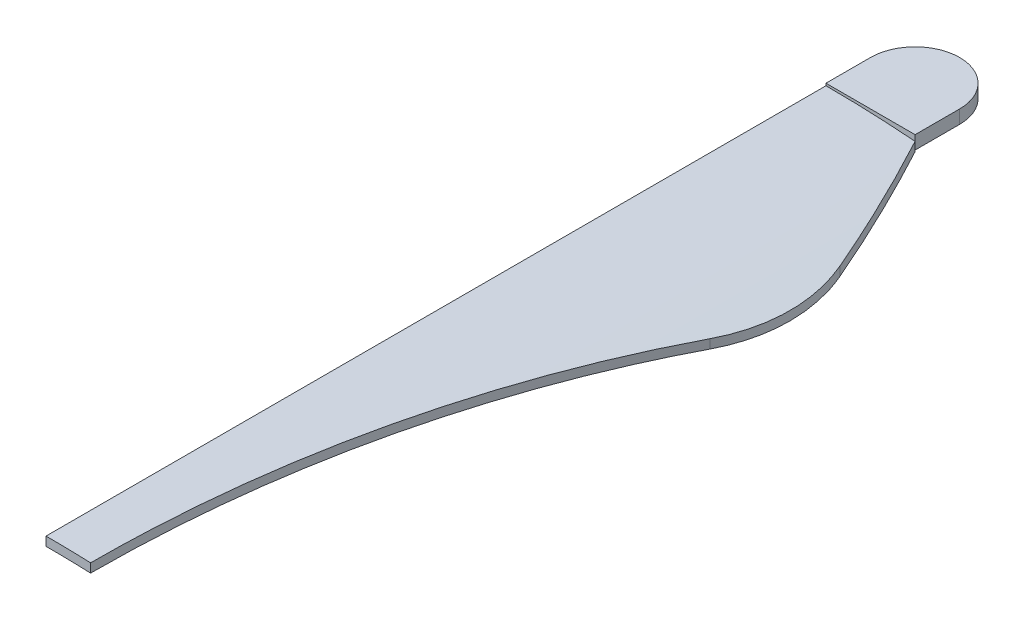
from build123d import *

# Parameters (mm, degrees)
EXTRUDE_1_DEPTH          = 350
EXTRUDE_2_DEPTH          = 1
EXTRUDE_2_DEPTH_BACK     = 5
CUT_EXTRUDE_1_DEPTH      = 360.210404844
CUT_EXTRUDE_1_DEPTH_BACK = 360.210404844
SKETCH_4_OUTSIDE_W       = 161.658
SKETCH_4_OUTSIDE_H       = 471.658


with BuildPart() as part:
    # 草图2 → 凸台-拉伸1 (new body)
    with BuildSketch(Plane.XY):
        with BuildLine():
            Line((80, -10.494126695), (80, -6.44149283))
            ThreePointArc((80, -6.44149283), (40.129455609, -1.612974895), (0, 0))
            Line((0, 0), (0, -4))
            ThreePointArc((0, -4), (40.131576351, -5.626197519), (80, -10.494126695))
        make_face()
    extrude(amount=EXTRUDE_1_DEPTH)

    # 草图3 → 凸台-拉伸2 (add, two sides: drawn at the far end of the back side and taken through both)
    with BuildSketch(Plane(origin=(0, 0, 0), x_dir=(1, 0, 0), z_dir=(0, 1, 0)).offset(-EXTRUDE_2_DEPTH_BACK)):
        with BuildLine():
            Line((0, 0), (0, 20))
            ThreePointArc((0, 20), (20, 40), (40, 20))
            Line((40, 20), (40, 0))
            Line((40, 0), (0, 0))
        make_face()
    extrude(amount=EXTRUDE_2_DEPTH + EXTRUDE_2_DEPTH_BACK)

    # 草图4 outside → 切除-拉伸1 (cut, two sides: drawn at the far end of the back side and taken through both)
    with BuildSketch(Plane(origin=(0, 1, 0), x_dir=(1, 0, 0), z_dir=(0, 1, 0)).offset(-CUT_EXTRUDE_1_DEPTH_BACK)):
        with Locations((40, -155)):
            Rectangle(SKETCH_4_OUTSIDE_W, SKETCH_4_OUTSIDE_H)
        with BuildLine():
            Line((0, -350), (20, -350))
            ThreePointArc((20, -350), (32.037873221, -232.445661311), (67.651801878, -119.770992366))
            ThreePointArc((67.651801878, -119.770992366), (73.805604709, -91.100068227), (68.49542517, -62.260977161))
            ThreePointArc((68.49542517, -62.260977161), (55.031874412, -30.771595648), (40, 0))
            Line((40, 0), (40, 103.702750203))
            Line((40, 103.702750203), (-64.531778678, 103.702750203))
            Line((-64.531778678, 103.702750203), (-64.531778678, -350))
            Line((-64.531778678, -350), (0, -350))
        make_face(mode=Mode.SUBTRACT)
    extrude(amount=CUT_EXTRUDE_1_DEPTH + CUT_EXTRUDE_1_DEPTH_BACK, mode=Mode.SUBTRACT)


solid = part.part
